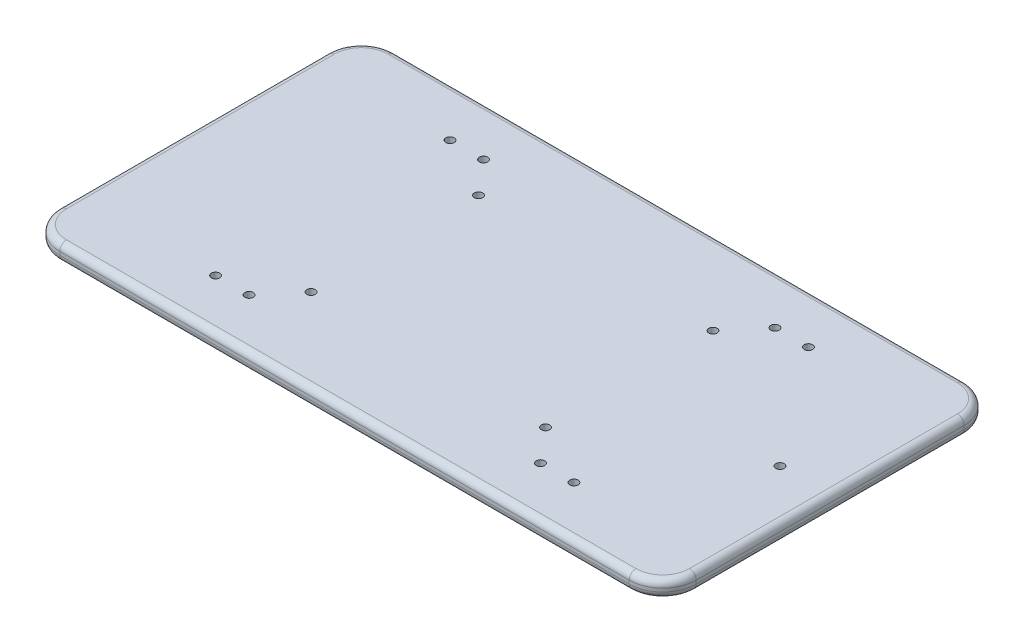
from build123d import *

# Parameters (mm, degrees)
SKETCH1_W           = 190
SKETCH1_H           = 100
SKETCH1_R           = 1.25
BOSS_EXTRUDE1_DEPTH = 5
FILLET1_R           = 10
FILLET2_R           = 2
SCALE1_SCALE        = 18


with BuildPart() as part:
    # Sketch1 → Boss-Extrude1 (new body)
    with BuildSketch(Plane(origin=(0, 0, 0), x_dir=(1, 0, 0), z_dir=(0, 1, 0))):
        Rectangle(SKETCH1_W, SKETCH1_H)
        with Locations(Location((-35, 25, 0), (0, 0, 270))):
            Circle(SKETCH1_R, mode=Mode.SUBTRACT)
        with Locations(Location((35, 25, 0), (0, 0, 270))):
            Circle(SKETCH1_R, mode=Mode.SUBTRACT)
        with Locations(Location((35, -25, 0), (0, 0, 270))):
            Circle(SKETCH1_R, mode=Mode.SUBTRACT)
        with Locations(Location((-35, -25, 0), (0, 0, 270))):
            Circle(SKETCH1_R, mode=Mode.SUBTRACT)
        with Locations(Location((80, 0, 0), (0, 0, 270))):
            Circle(SKETCH1_R, mode=Mode.SUBTRACT)
        with Locations(Location((-53.5, -35, 0), (0, 0, 270))):
            Circle(SKETCH1_R, mode=Mode.SUBTRACT)
        with Locations(Location((-43.5, -35, 0), (0, 0, 270))):
            Circle(SKETCH1_R, mode=Mode.SUBTRACT)
        with Locations(Location((-43.5, 35, 0), (0, 0, 90))):
            Circle(SKETCH1_R, mode=Mode.SUBTRACT)
        with Locations(Location((-53.5, 35, 0), (0, 0, 90))):
            Circle(SKETCH1_R, mode=Mode.SUBTRACT)
        with Locations(Location((43.5, 35, 0), (0, 0, 270))):
            Circle(SKETCH1_R, mode=Mode.SUBTRACT)
        with Locations(Location((53.5, 35, 0), (0, 0, 270))):
            Circle(SKETCH1_R, mode=Mode.SUBTRACT)
        with Locations(Location((53.5, -35, 0), (0, 0, 90))):
            Circle(SKETCH1_R, mode=Mode.SUBTRACT)
        with Locations(Location((43.5, -35, 0), (0, 0, 90))):
            Circle(SKETCH1_R, mode=Mode.SUBTRACT)
    extrude(amount=BOSS_EXTRUDE1_DEPTH)

    # Fillet1
    fillet1_edges = [part.edges().sort_by_distance(p)[0] for p in [
        (95, 2.5, 50),
        (-95, 2.5, 50),
        (-95, 2.5, -50),
        (95, 2.5, -50),
    ]]
    fillet(fillet1_edges, radius=FILLET1_R)

    # Fillet2
    fillet2_edges = [part.edges().sort_by_distance(p)[0] for p in [
        (95, 0, 0),
        (95, 5, 0),
        (0, 0, 50),
        (-95, 0, 0),
        (0, 0, -50),
        (-92.071067812, 0, 47.071067812),
        (-92.071067812, 0, -47.071067812),
        (92.071067812, 0, -47.071067812),
        (92.071067812, 0, 47.071067812),
        (0, 5, 50),
        (0, 5, -50),
        (-95, 5, 0),
        (-92.071067812, 5, 47.071067812),
        (-92.071067812, 5, -47.071067812),
        (92.071067812, 5, -47.071067812),
        (92.071067812, 5, 47.071067812),
    ]]
    fillet(fillet2_edges, radius=FILLET2_R)


with BuildPart() as part_1:
    # Scale1: scaled about (-0.021047162, 2.5, 0)
    add(part.part.scale(SCALE1_SCALE).moved(Location((0.357801754, -42.5, 0))))


solid = part_1.part
